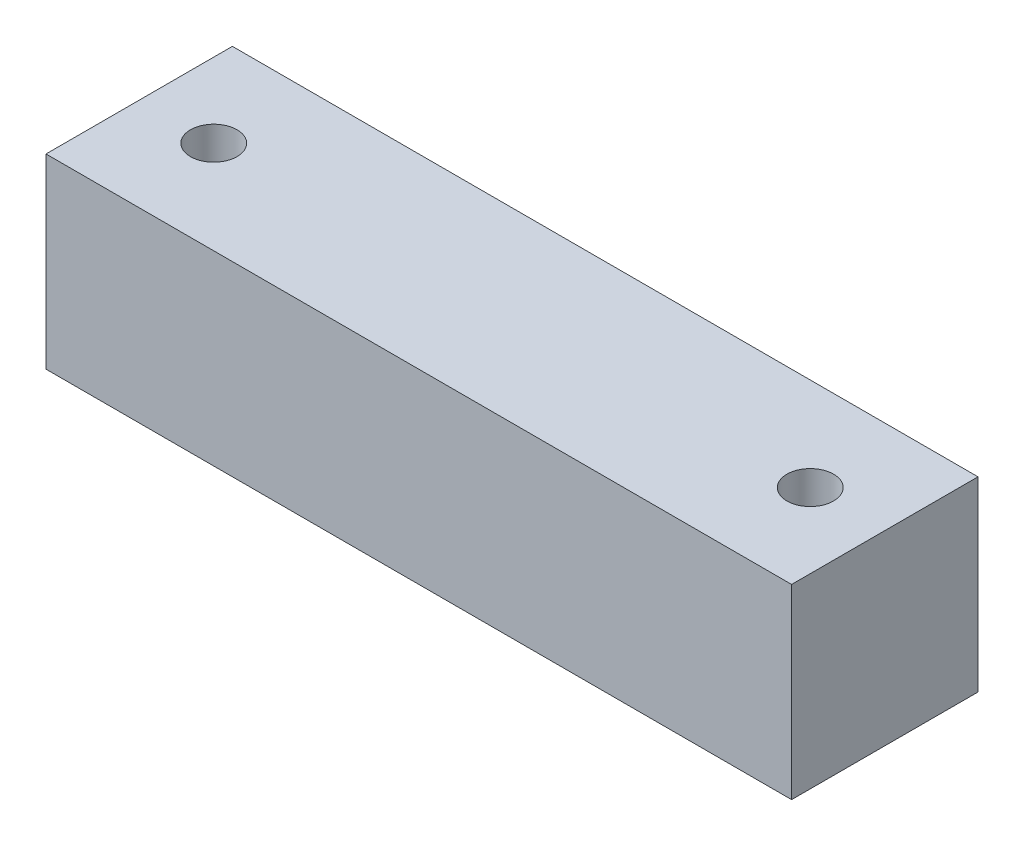
from build123d import *

# Parameters (mm, degrees)
SKETCH1_W                   = 40
SKETCH1_H                   = 10
BOSS_EXTRUDE1_DEPTH         = 10
TAP_DRILL_FOR_M3X0_5_TAP1_D = 2.5


with BuildPart() as part:
    # Sketch1 → Boss-Extrude1 (new body)
    with BuildSketch(Plane.XY):
        Rectangle(SKETCH1_W, SKETCH1_H)
    extrude(amount=BOSS_EXTRUDE1_DEPTH)

    # Tap Drill for M3x0.5 Tap1 (through all)
    with Locations(Plane(origin=(0, -5, 0), x_dir=(-1, 0, 0), z_dir=(0, -1, 0))):
        with Locations((16, -5), (-16, -5)):
            Hole(TAP_DRILL_FOR_M3X0_5_TAP1_D / 2)


solid = part.part
